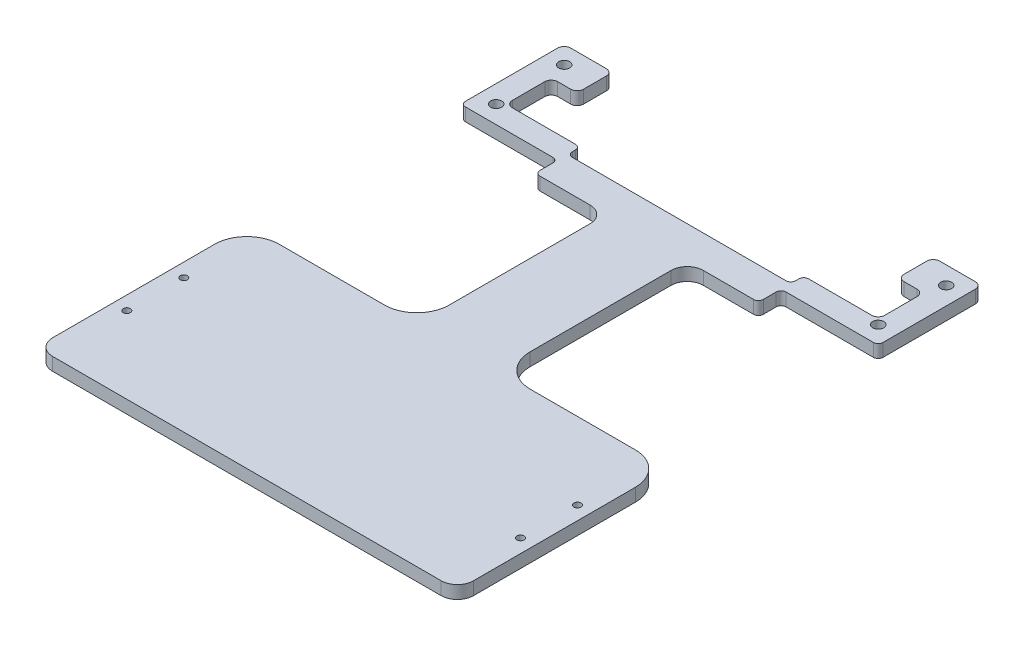
from build123d import *

# Parameters (mm, degrees)
SKETCH2_R           = 1.7
SKETCH2_R_2         = 1.1
BOSS_EXTRUDE1_DEPTH = 4
FILLET1_R           = 5


with BuildPart() as part:
    # Sketch2 → Boss-Extrude1 (new body)
    with BuildSketch(Plane(origin=(0, 0, 0), x_dir=(1, 0, 0), z_dir=(0, 1, 0))):
        with BuildLine():
            Line((-33, -13), (33, -13))
            ThreePointArc((33, -13), (34.060660172, -12.560660172), (34.5, -11.5))
            Line((34.5, -11.5), (34.5, -10.5))
            ThreePointArc((34.5, -10.5), (34.939339828, -9.439339828), (36, -9))
            Line((36, -9), (55.5, -9))
            ThreePointArc((55.5, -9), (56.914213562, -8.414213562), (57.5, -7))
            Line((57.5, -7), (57.5, 3))
            ThreePointArc((57.5, 3), (56.914213562, 4.414213562), (55.5, 5))
            Line((55.5, 5), (51.5, 5))
            ThreePointArc((51.5, 5), (50.085786438, 5.585786438), (49.5, 7))
            Line((49.5, 7), (49.5, 14))
            ThreePointArc((49.5, 14), (50.085786438, 15.414213562), (51.5, 16))
            Line((51.5, 16), (62.5, 16))
            ThreePointArc((62.5, 16), (63.914213562, 15.414213562), (64.5, 14))
            Line((64.5, 14), (64.5, -13))
            Line((64.5, -13), (64.5, -14.5))
            ThreePointArc((64.5, -14.5), (64.060660172, -15.560660172), (63, -16))
            Line((63, -16), (36, -16))
            ThreePointArc((36, -16), (34.939339828, -16.439339828), (34.5, -17.5))
            Line((34.5, -17.5), (34.5, -21.5))
            ThreePointArc((34.5, -21.5), (34.060660172, -22.560660172), (33, -23))
            Line((33, -23), (17.5, -23))
            ThreePointArc((17.5, -23), (13.964466094, -24.464466094), (12.5, -28))
            Line((12.5, -28), (12.5, -56.5))
            Line((12.5, -56.5), (12.5, -71.5))
            ThreePointArc((12.5, -71.5), (15.428932188, -78.571067812), (22.5, -81.5))
            Line((22.5, -81.5), (55, -81.5))
            ThreePointArc((55, -81.5), (62.071067812, -84.428932188), (65, -91.5))
            Line((65, -91.5), (65, -146.5))
            Line((65, -146.5), (-65, -146.5))
            Line((-65, -146.5), (-65, -91.5))
            ThreePointArc((-65, -91.5), (-62.071067812, -84.428932188), (-55, -81.5))
            Line((-55, -81.5), (-25, -81.5))
            Line((-25, -81.5), (-22.5, -81.5))
            ThreePointArc((-22.5, -81.5), (-15.428932188, -78.571067812), (-12.5, -71.5))
            Line((-12.5, -71.5), (-12.5, -56.5))
            Line((-12.5, -56.5), (-12.5, -28))
            ThreePointArc((-12.5, -28), (-13.964466094, -24.464466094), (-17.5, -23))
            Line((-17.5, -23), (-33, -23))
            ThreePointArc((-33, -23), (-34.060660172, -22.560660172), (-34.5, -21.5))
            Line((-34.5, -21.5), (-34.5, -17.5))
            ThreePointArc((-34.5, -17.5), (-34.939339828, -16.439339828), (-36, -16))
            Line((-36, -16), (-63, -16))
            ThreePointArc((-63, -16), (-64.060660172, -15.560660172), (-64.5, -14.5))
            Line((-64.5, -14.5), (-64.5, -13))
            Line((-64.5, -13), (-64.5, 14))
            ThreePointArc((-64.5, 14), (-63.914213562, 15.414213562), (-62.5, 16))
            Line((-62.5, 16), (-51.5, 16))
            ThreePointArc((-51.5, 16), (-50.085786438, 15.414213562), (-49.5, 14))
            Line((-49.5, 14), (-49.5, 7))
            ThreePointArc((-49.5, 7), (-50.085786438, 5.585786438), (-51.5, 5))
            Line((-51.5, 5), (-55.5, 5))
            ThreePointArc((-55.5, 5), (-56.914213562, 4.414213562), (-57.5, 3))
            Line((-57.5, 3), (-57.5, -7))
            ThreePointArc((-57.5, -7), (-56.914213562, -8.414213562), (-55.5, -9))
            Line((-55.5, -9), (-36, -9))
            ThreePointArc((-36, -9), (-34.939339828, -9.439339828), (-34.5, -10.5))
            Line((-34.5, -10.5), (-34.5, -11.5))
            ThreePointArc((-34.5, -11.5), (-34.060660172, -12.560660172), (-33, -13))
        make_face()
        with Locations(Location((59, 10.5, 0), (0, 0, 270))):
            Circle(SKETCH2_R, mode=Mode.SUBTRACT)
        with Locations(Location((-59, 10.5, 0), (0, 0, 90))):
            Circle(SKETCH2_R, mode=Mode.SUBTRACT)
        with Locations(Location((-59, -10.5, 0), (0, 0, 270))):
            Circle(SKETCH2_R, mode=Mode.SUBTRACT)
        with Locations(Location((59, -10.5, 0), (0, 0, 90))):
            Circle(SKETCH2_R, mode=Mode.SUBTRACT)
        with Locations(Location((-60.8, -105.2, 0), (0, 0, 270))):
            Circle(SKETCH2_R_2, mode=Mode.SUBTRACT)
        with Locations(Location((-60.8, -122.8, 0), (0, 0, 90))):
            Circle(SKETCH2_R_2, mode=Mode.SUBTRACT)
        with Locations(Location((60.8, -122.8, 0), (0, 0, 270))):
            Circle(SKETCH2_R_2, mode=Mode.SUBTRACT)
        with Locations(Location((60.8, -105.2, 0), (0, 0, 90))):
            Circle(SKETCH2_R_2, mode=Mode.SUBTRACT)
    extrude(amount=BOSS_EXTRUDE1_DEPTH)

    # Fillet1
    fillet1_edges = [part.edges().sort_by_distance(p)[0] for p in [
        (65, 2, 146.5),
        (-65, 2, 146.5),
    ]]
    fillet(fillet1_edges, radius=FILLET1_R)


solid = part.part
